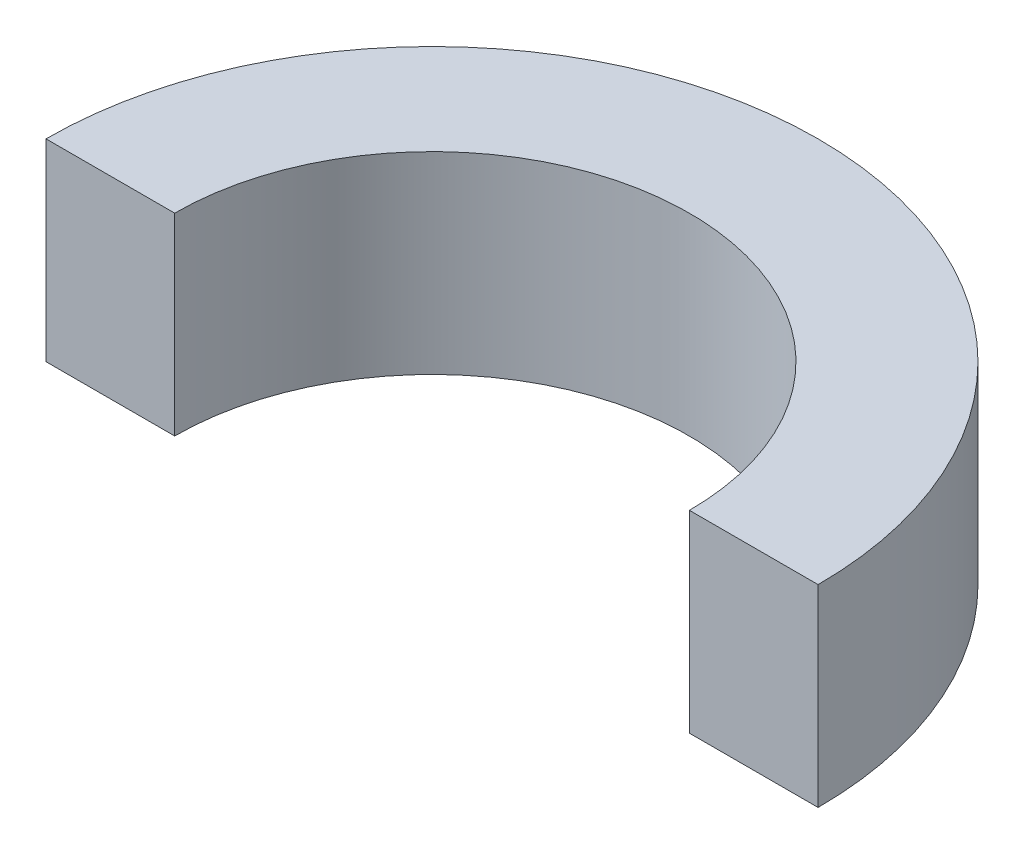
from build123d import *

# Parameters (mm, degrees)
BOSS_EXTRUDE1_DEPTH = 15


with BuildPart() as part:
    # Sketch1 → Boss-Extrude1 (new body)
    with BuildSketch(Plane(origin=(0, 0, 0), x_dir=(1, 0, 0), z_dir=(0, 1, 0))):
        with BuildLine():
            Line((-30, 0), (-20, 0))
            ThreePointArc((-20, 0), (0, 20), (20, 0))
            Line((20, 0), (30, 0))
            ThreePointArc((30, 0), (0, 30), (-30, 0))
        make_face()
    extrude(amount=BOSS_EXTRUDE1_DEPTH)


solid = part.part
